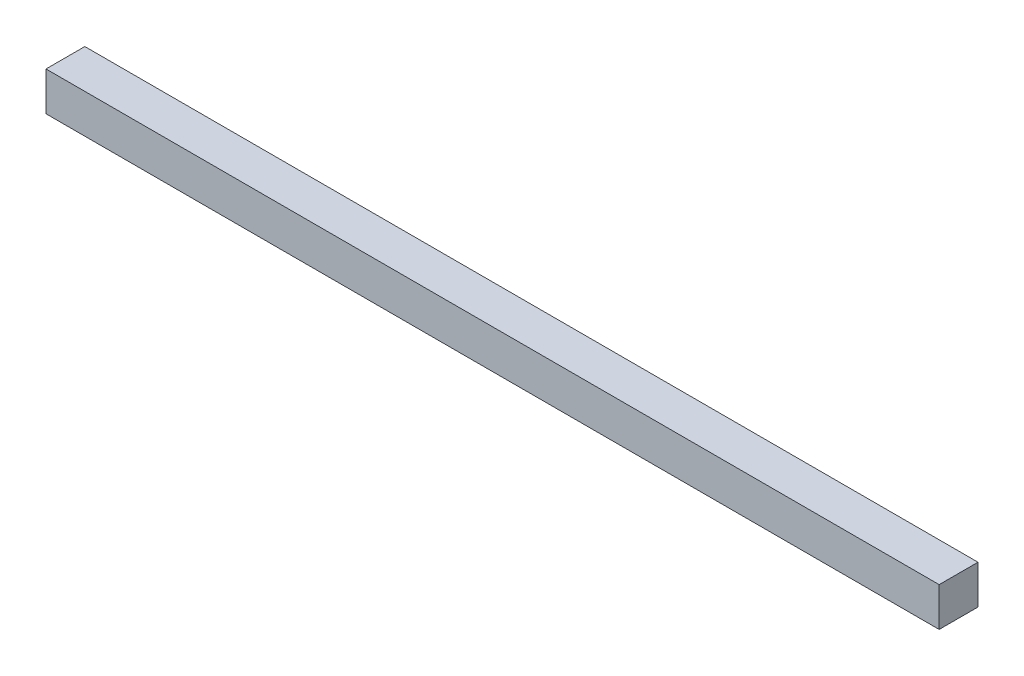
from build123d import *

# Parameters (mm, degrees)
SKETCH_1_W      = 690
SKETCH_1_H      = 30
EXTRUDE_1_DEPTH = 30


with BuildPart() as part:
    # Эскиз1 → Бобышка-Вытянуть1 (new body)
    with BuildSketch(Plane.XY):
        with Locations((389.050320868, 22.631091658)):
            Rectangle(SKETCH_1_W, SKETCH_1_H)
    extrude(amount=EXTRUDE_1_DEPTH)


solid = part.part
